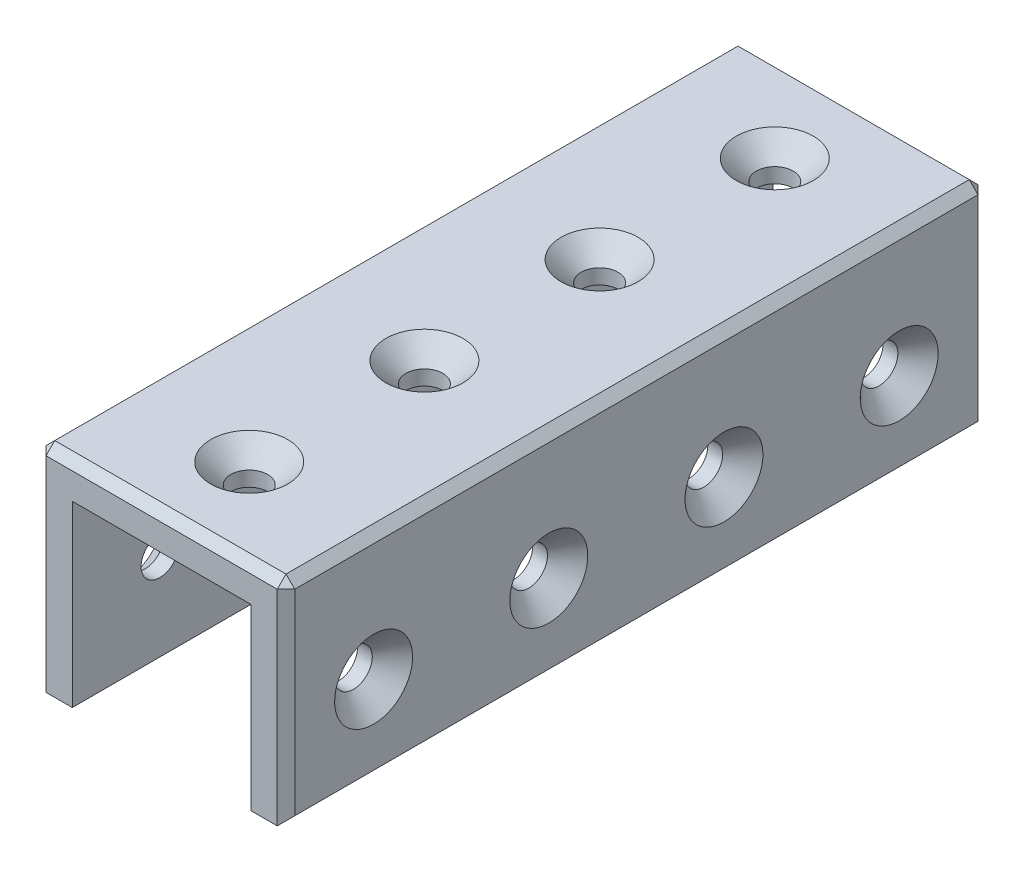
from build123d import *

# Parameters (mm, degrees)
BOSS_EXTRUDE1_DEPTH = 80
SKETCH2_R           = 2.15
CUT_EXTRUDE1_DEPTH  = 89.328477854
SKETCH3_R           = 2.1
CUT_EXTRUDE2_DEPTH  = 85.835134231
CHAMFER1_SIZE       = 2.3
CHAMFER2_SIZE       = 1


with BuildPart() as part:
    # Sketch1 → Boss-Extrude1 (new body)
    with BuildSketch(Plane.XY):
        Polygon((-10.2, 0), (-10.2, 20.4), (10.2, 20.4), (10.2, 0), (14.2, 0), (14.2, 24.4), (-14.2, 24.4), (-14.2, 0), align=None)
    extrude(amount=BOSS_EXTRUDE1_DEPTH)

    # Sketch2 → Cut-Extrude1 (cut, through all)
    with BuildSketch(Plane(origin=(14.2, 0, 0), x_dir=(0, 0, -1), z_dir=(1, 0, 0))):
        with Locations(Location((-50, 10, 0), (0, 0, 90))):
            Circle(SKETCH2_R)
        with Locations(Location((-70, 10, 0), (0, 0, 90))):
            Circle(SKETCH2_R)
        with Locations(Location((-30, 10, 0), (0, 0, 90))):
            Circle(SKETCH2_R)
        with Locations(Location((-10, 10, 0), (0, 0, 90))):
            Circle(SKETCH2_R)
    extrude(amount=-CUT_EXTRUDE1_DEPTH, mode=Mode.SUBTRACT)

    # Sketch3 → Cut-Extrude2 (cut, through all)
    with BuildSketch(Plane(origin=(0, 24.4, 0), x_dir=(1, 0, 0), z_dir=(0, 1, 0))):
        with Locations(Location((0, -10, 0), (0, 0, 180))):
            Circle(SKETCH3_R)
        with Locations(Location((0, -30, 0), (0, 0, 180))):
            Circle(SKETCH3_R)
        with Locations(Location((0, -50, 0), (0, 0, 180))):
            Circle(SKETCH3_R)
        with Locations(Location((0, -70, 0), (0, 0, 180))):
            Circle(SKETCH3_R)
    extrude(amount=-CUT_EXTRUDE2_DEPTH, mode=Mode.SUBTRACT)

    # Chamfer1
    chamfer1_edges = [part.edges().sort_by_distance(p)[0] for p in [
        (-14.2, 7.85, 10),
        (14.2, 7.85, 10),
        (-14.2, 7.85, 30),
        (14.2, 7.85, 30),
        (-14.2, 7.85, 70),
        (14.2, 7.85, 70),
        (-14.2, 7.85, 50),
        (14.2, 7.85, 50),
        (2.1, 24.4, 10),
        (2.1, 24.4, 30),
        (2.1, 24.4, 50),
        (2.1, 24.4, 70),
    ]]
    chamfer(chamfer1_edges, length=CHAMFER1_SIZE)

    # Chamfer2
    chamfer2_edges = [part.edges().sort_by_distance(p)[0] for p in [
        (-14.2, 0, 40),
        (-14.2, 24.4, 40),
        (14.2, 24.4, 40),
        (14.2, 0, 40),
        (14.2, 12.2, 80),
        (0, 24.4, 80),
        (-14.2, 12.2, 80),
        (-14.2, 12.2, 0),
        (0, 24.4, 0),
        (14.2, 12.2, 0),
    ]]
    chamfer(chamfer2_edges, length=CHAMFER2_SIZE)


solid = part.part
